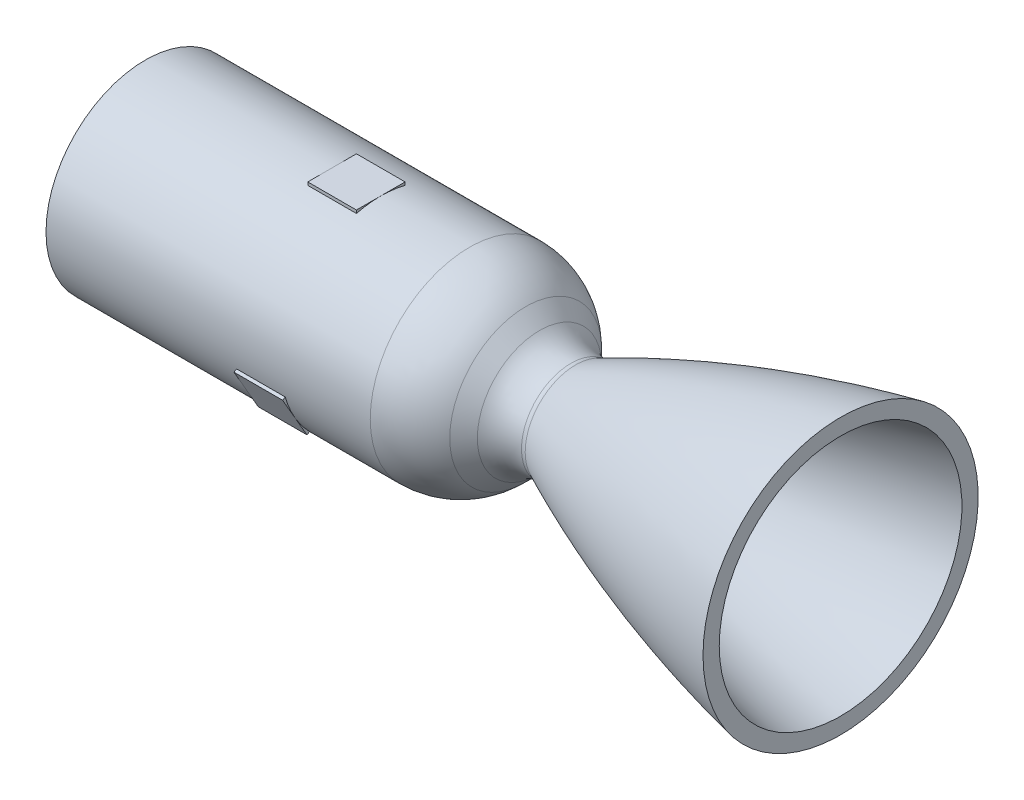
from build123d import *

# Parameters (mm, degrees)
BOSS_EXTRUDE1_START = -1.185383
SKETCH2_W           = 19.05
SKETCH2_H           = 19.05
BOSS_EXTRUDE1_DEPTH = 1.185383
CIRPATTERN1_COUNT   = 3


with BuildPart() as part:
    # Sketch1 → Revolve1 (revolve)
    with BuildSketch(Plane.XY, mode=Mode.PRIVATE) as revolve1_sk:
        with BuildLine():
            Line((-14.12409666, 4.594554961), (-19.526618742, 9.997077044))
            ThreePointArc((-19.526618742, 9.997077044), (-29.623523347, 16.74361301), (-41.533634393, 19.112681394))
            Line((-41.533634393, 19.112681394), (-168.447274393, 19.112681394))
            Line((-168.447274393, 19.112681394), (-168.447274393, 25.462681394))
            Line((-168.447274393, 25.462681394), (-41.533634392, 25.462681394))
            ThreePointArc((-41.533634392, 25.462681394), (-29.623523346, 23.09361301), (-19.526618741, 16.347077044))
            Line((-19.526618741, 16.347077044), (-14.124096659, 10.944554962))
            ThreePointArc((-14.124096659, 10.944554962), (-8.491312805, 7.221332923), (-1.862483701, 5.937097346))
            ThreePointArc((-1.862483701, 5.937097346), (-0.908631777, 6.041561122), (-5.2e-08, 6.350000031))
            add(Edge.make_bspline(
                [(-5.2e-08, 6.350000031), (17.284276617, 14.409337901), (34.568553286, 21.376197316), (51.852829955, 27.377015197), (69.137106624, 32.507005795), (86.421383293, 36.843575686), (103.705659962, 40.451419137)],
                knots=[0.079490439, 0.079490439, 0.079490439, 0.079490439, 0.079490439, 0.079490439, 0.079490439, 0.916317313, 0.916317313, 0.916317313, 0.916317313, 0.916317313, 0.916317313, 0.916317313], degree=6))
            Line((103.705659962, 40.451419137), (103.705659962, 34.101419137))
            add(Edge.make_bspline(
                [(-5.3e-08, 3e-08), (17.284276616, 8.059337901), (34.568553285, 15.026197315), (51.852829954, 21.027015196), (69.137106623, 26.157005795), (86.421383292, 30.493575686), (103.705659962, 34.101419137)],
                knots=[0.079490439, 0.079490439, 0.079490439, 0.079490439, 0.079490439, 0.079490439, 0.079490439, 0.916317313, 0.916317313, 0.916317313, 0.916317313, 0.916317313, 0.916317313, 0.916317313], degree=6))
            ThreePointArc((-5.3e-08, 3e-08), (-0.908631778, -0.308438879), (-1.862483702, -0.412902654))
            ThreePointArc((-1.862483702, -0.412902654), (-8.491312805, 0.871332923), (-14.12409666, 4.594554961))
        make_face()
    revolve(revolve1_sk.sketch.rotate(Axis((-168.447274484, -13.3985, 0), (1, 0, 0)), 90), axis=Axis((-168.447274484, -13.3985, 0), (1, 0, 0)))

    # Sketch2 → Boss-Extrude1 (add)
    with BuildSketch(Plane(origin=(0, 25.462681394, 0), x_dir=(1, 0, 0), z_dir=(0, 1, 0)).offset(BOSS_EXTRUDE1_START)):
        with Locations((-85.799287115, 0)):
            Rectangle(SKETCH2_W, SKETCH2_H)
    boss_extrude1 = extrude(amount=BOSS_EXTRUDE1_DEPTH)

    # CirPattern1: Boss-Extrude1 ×3 about axis
    cirpattern1_axis = Axis((0, -13.3985, 0), (1, 0, 0))
    for i in range(1, CIRPATTERN1_COUNT):
        add(boss_extrude1.rotate(cirpattern1_axis, i * 360 / CIRPATTERN1_COUNT))


solid = part.part
